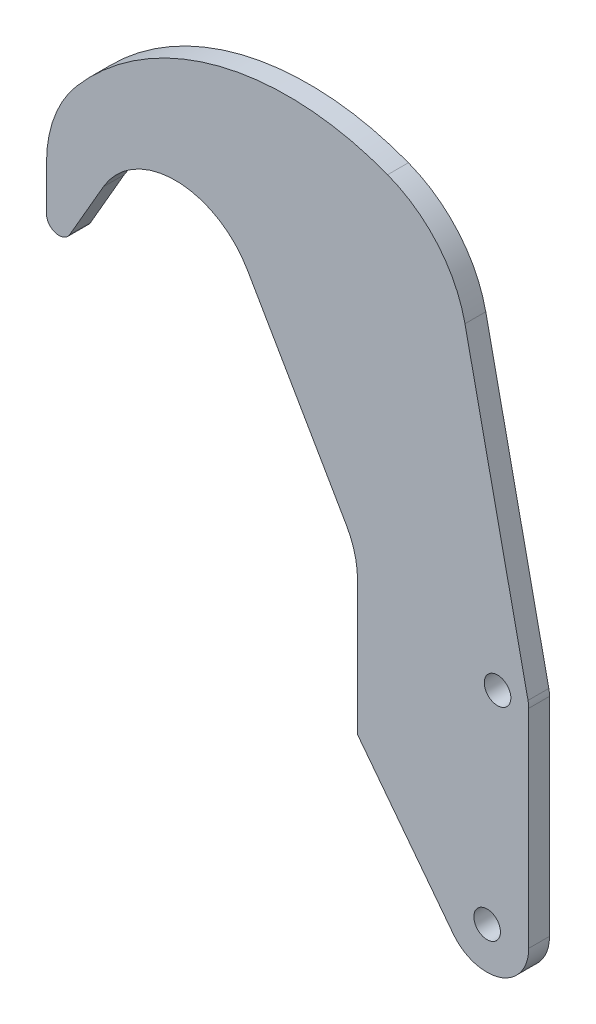
from build123d import *

# Parameters (mm, degrees)
SKETCH1_R           = 2.032
BOSS_EXTRUDE1_DEPTH = 1.5875
FILLET1_R           = 19.05


with BuildPart() as part:
    # Sketch1 → Boss-Extrude1 (new, symmetric)
    with BuildSketch(Plane.XY):
        with BuildLine():
            Line((10.998522628, 23.8125), (26.121491242, -2.38125))
            ThreePointArc((26.121491242, -2.38125), (27.390226607, -5.444248127), (27.822968614, -8.73125))
            Line((27.822968614, -8.73125), (27.822968614, -29.239270948))
            Line((27.822968614, -29.239270948), (42.458005799, -48.315226419))
            ThreePointArc((42.458005799, -48.315226419), (44.687348893, -50.145027996), (47.496113055, -50.8))
            Line((47.496113055, -50.8), (47.625, -50.8))
            ThreePointArc((47.625, -50.8), (52.115128061, -48.940128061), (53.975, -44.45))
            Line((53.975, -44.45), (53.975, -12.7))
            ThreePointArc((53.975, -12.7), (53.948566881, -12.198924408), (53.869560945, -11.703411017))
            Line((53.869560945, -11.703411017), (42.458005799, 41.622793369))
            ThreePointArc((42.458005799, 41.622793369), (8.463163904, 49.01990761), (-19.685944915, 28.575))
            Line((-19.685944915, 28.575), (-19.685944915, 15.875))
            ThreePointArc((-19.685944915, 15.875), (-18.273995196, 14.034911301), (-16.131166521, 14.9225))
            Line((-16.131166521, 14.9225), (-10.998522628, 23.8125))
            ThreePointArc((-10.998522628, 23.8125), (0, 30.1625), (10.998522628, 23.8125))
        make_face()
        with Locations((47.625, -44.45)):
            Circle(SKETCH1_R, mode=Mode.SUBTRACT)
        with Locations((49.2125, -12.7)):
            Circle(SKETCH1_R, mode=Mode.SUBTRACT)
    extrude(amount=BOSS_EXTRUDE1_DEPTH, both=True)

    # Fillet1
    fillet1_edges = [part.edges().sort_by_distance(p)[0] for p in [
        (-19.685944915, 28.575, 0),
        (42.458005799, 41.622793369, 0),
    ]]
    fillet(fillet1_edges, radius=FILLET1_R)


solid = part.part
